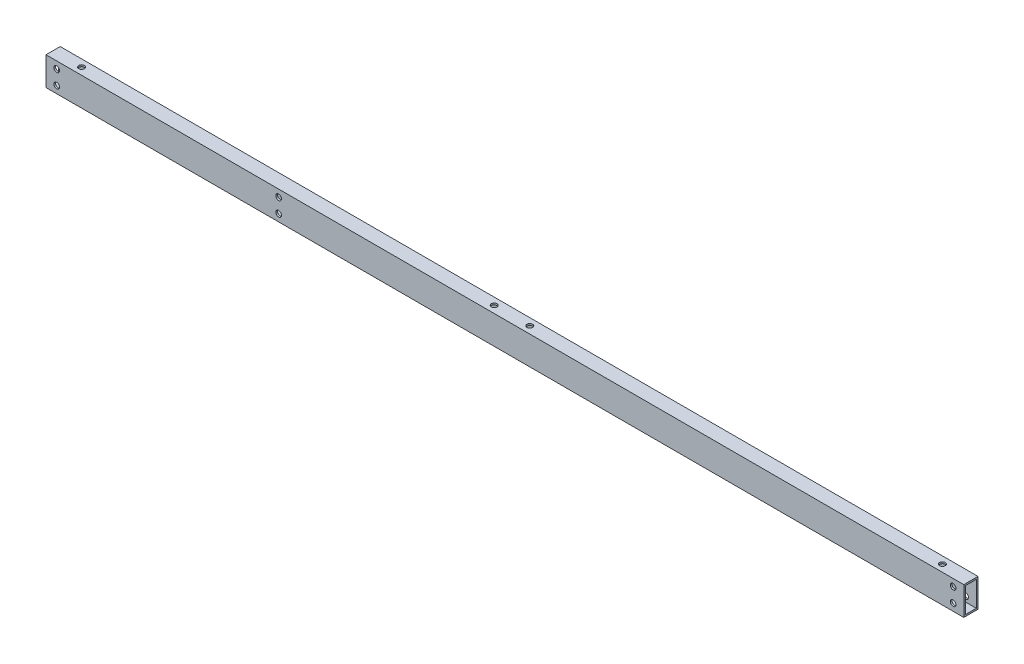
from build123d import *

# Parameters (mm, degrees)
SKETCH_1_W          = 10
SKETCH_1_H          = 20
SKETCH_1_W_2        = 7.6
SKETCH_1_H_2        = 17.6
EXTRUDE_1_DEPTH     = 645
SKETCH_2_R          = 2
CUT_EXTRUDE_1_DEPTH = 646.155020131
SKETCH_3_R          = 2
CUT_EXTRUDE_2_DEPTH = 646.329373266


with BuildPart() as part:
    # ｽｹｯﾁ1 → 押し出し-薄板1 (new body)
    with BuildSketch(Plane(origin=(0, 0, 0), x_dir=(0, 0, -1), z_dir=(1, 0, 0))):
        Rectangle(SKETCH_1_W, SKETCH_1_H)
        Rectangle(SKETCH_1_W_2, SKETCH_1_H_2, mode=Mode.SUBTRACT)
    extrude(amount=EXTRUDE_1_DEPTH)

    # ｽｹｯﾁ2 → ｶｯﾄ - 押し出し1 (cut, through all)
    with BuildSketch(Plane.XY.offset(5)):
        with Locations((163.5, -5)):
            Circle(SKETCH_2_R)
        with Locations(Location((163.5, 5, 0), (0, 0, 90))):
            Circle(SKETCH_2_R)
        with Locations((637.5, 5)):
            Circle(SKETCH_2_R)
        with Locations(Location((637.5, -5, 0), (0, 0, 90))):
            Circle(SKETCH_2_R)
        with Locations((7.5, -5)):
            Circle(SKETCH_2_R)
        with Locations(Location((7.5, 5, 0), (0, 0, 90))):
            Circle(SKETCH_2_R)
    extrude(amount=-CUT_EXTRUDE_1_DEPTH, mode=Mode.SUBTRACT)

    # ｽｹｯﾁ3 → ｶｯﾄ - 押し出し2 (cut, through all)
    with BuildSketch(Plane(origin=(0, 10, 0), x_dir=(1, 0, 0), z_dir=(0, 1, 0))):
        with Locations(Location((20, 0, 0), (0, 0, 270))):
            Circle(SKETCH_3_R)
        with Locations(Location((625, 0, 0), (0, 0, 270))):
            Circle(SKETCH_3_R)
        with Locations(Location((310, 0, 0), (0, 0, 270))):
            Circle(SKETCH_3_R)
        with Locations(Location((335, 0, 0), (0, 0, 270))):
            Circle(SKETCH_3_R)
    extrude(amount=-CUT_EXTRUDE_2_DEPTH, mode=Mode.SUBTRACT)


solid = part.part
